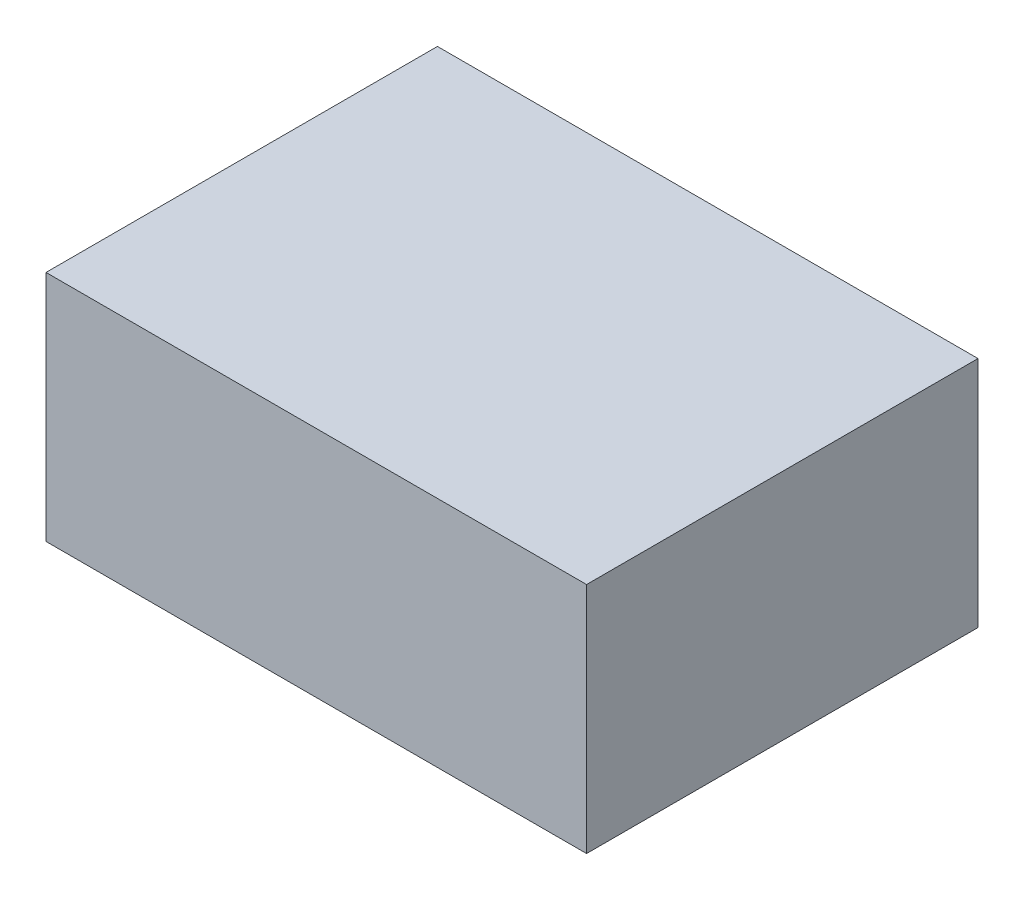
from build123d import *

# Parameters (mm, degrees)
SKETCH1_W           = 29
SKETCH1_H           = 12.5
BOSS_EXTRUDE1_DEPTH = 21


with BuildPart() as part:
    # Sketch1 → Boss-Extrude1 (new body)
    with BuildSketch(Plane.XY):
        with Locations((14.5, 6.25)):
            Rectangle(SKETCH1_W, SKETCH1_H)
    extrude(amount=BOSS_EXTRUDE1_DEPTH)


solid = part.part
